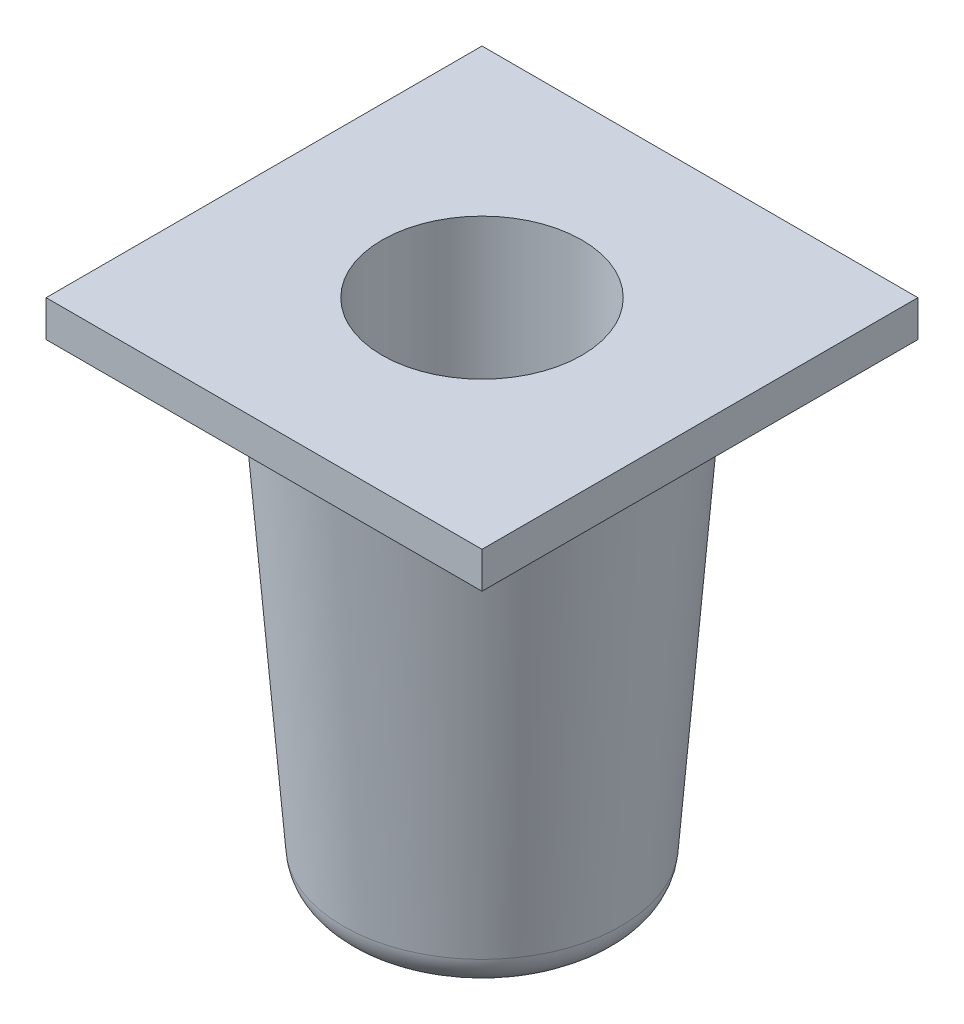
from build123d import *

# Parameters (mm, degrees)
SCHIZZO1_W                   = 12
SCHIZZO1_H                   = 12
SCHIZZO1_R                   = 2.75
ESTRUSIONE_ESTRUSIONE1_DEPTH = 1
RACCORDO1_R                  = 1


with BuildPart() as part:
    # Schizzo1 → Estrusione-Estrusione1 (new body)
    with BuildSketch(Plane(origin=(0, 0, 0), x_dir=(1, 0, 0), z_dir=(0, 1, 0))):
        Rectangle(SCHIZZO1_W, SCHIZZO1_H)
        with Locations(Location((0, 0, 0), (0, 0, 270))):
            Circle(SCHIZZO1_R, mode=Mode.SUBTRACT)
    extrude(amount=ESTRUSIONE_ESTRUSIONE1_DEPTH)

    # Schizzo2 → Rivoluzione1 (revolve)
    with BuildSketch(Plane.XY, mode=Mode.PRIVATE) as rivoluzione1_sk:
        Polygon((3.75, -13), (2.75, -13), (2.75, 0), (4.748642917, 0), align=None)
    revolve(rivoluzione1_sk.sketch.rotate(Axis((0, 0, 0), (0, -1, 0)), 90), axis=Axis((0, 0, 0), (0, -1, 0)))

    # Raccordo1
    raccordo1_edges = [part.edges().sort_by_distance(p)[0] for p in [
        (0, -13, -3.75),
    ]]
    fillet(raccordo1_edges, radius=RACCORDO1_R)


solid = part.part
